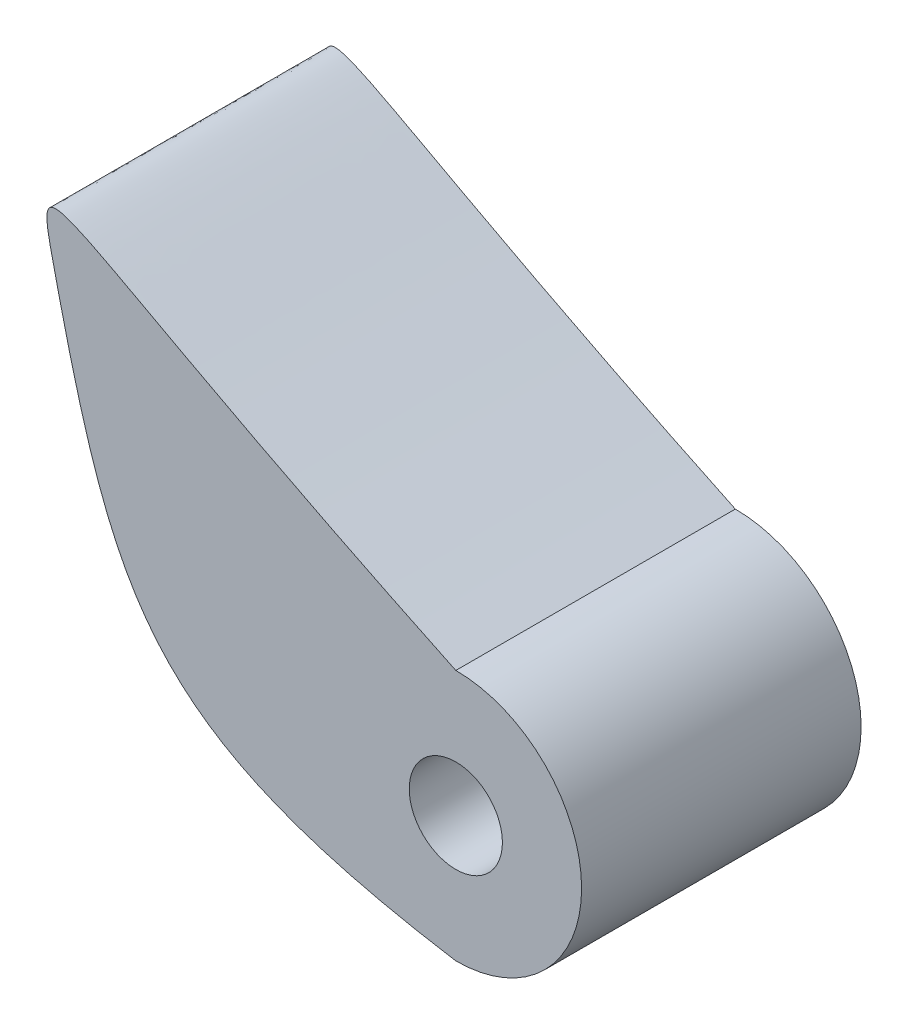
from build123d import *

# Parameters (mm, degrees)
ESQUISSE1_R        = 2.5
BOSS_EXTRU_2_DEPTH = 15


with BuildPart() as part:
    # Esquisse1 → Boss.-Extru.2 (new body)
    # profile 1 of 2: a face of its own
    with BuildSketch(Plane.XY):
        with BuildLine():
            ThreePointArc((0, -6.75), (4.772970773, -4.772970773), (6.75, 0))
            ThreePointArc((6.75, 0), (4.772970773, 4.772970773), (0, 6.75))
            ThreePointArc((0, 6.75), (-6.646414433, 1.177996257), (-2.31983743, -6.338836983))
            add(Edge.make_bspline(
                [(0, -6.75), (-0.807777295, -6.618832152), (-1.580434219, -6.482004779), (-2.31983743, -6.338836983)],
                knots=[0, 0, 0, 0, 0.026979852, 0.026979852, 0.026979852, 0.026979852], degree=3))
        make_face()
        Circle(ESQUISSE1_R, mode=Mode.SUBTRACT)
    # profile 2 of 2: a face of its own
    with BuildSketch(Plane.XY):
        with BuildLine():
            ThreePointArc((-2.31983743, -6.338836983), (-6.646414433, 1.177996257), (0, 6.75))
            add(Edge.make_bspline(
                [(-2.31983743, -6.338836983), (-13.334591404, -4.206092597), (-18.350455103, 0.67804092), (-23.113904115, 21.466831196), (-22.162082805, 17.286541146), (0, 6.75)],
                knots=[0.026979852, 0.026979852, 0.026979852, 0.026979852, 0.42889375, 0.5815344, 1, 1, 1, 1], degree=3))
        make_face()
    extrude(amount=-BOSS_EXTRU_2_DEPTH)


solid = part.part
